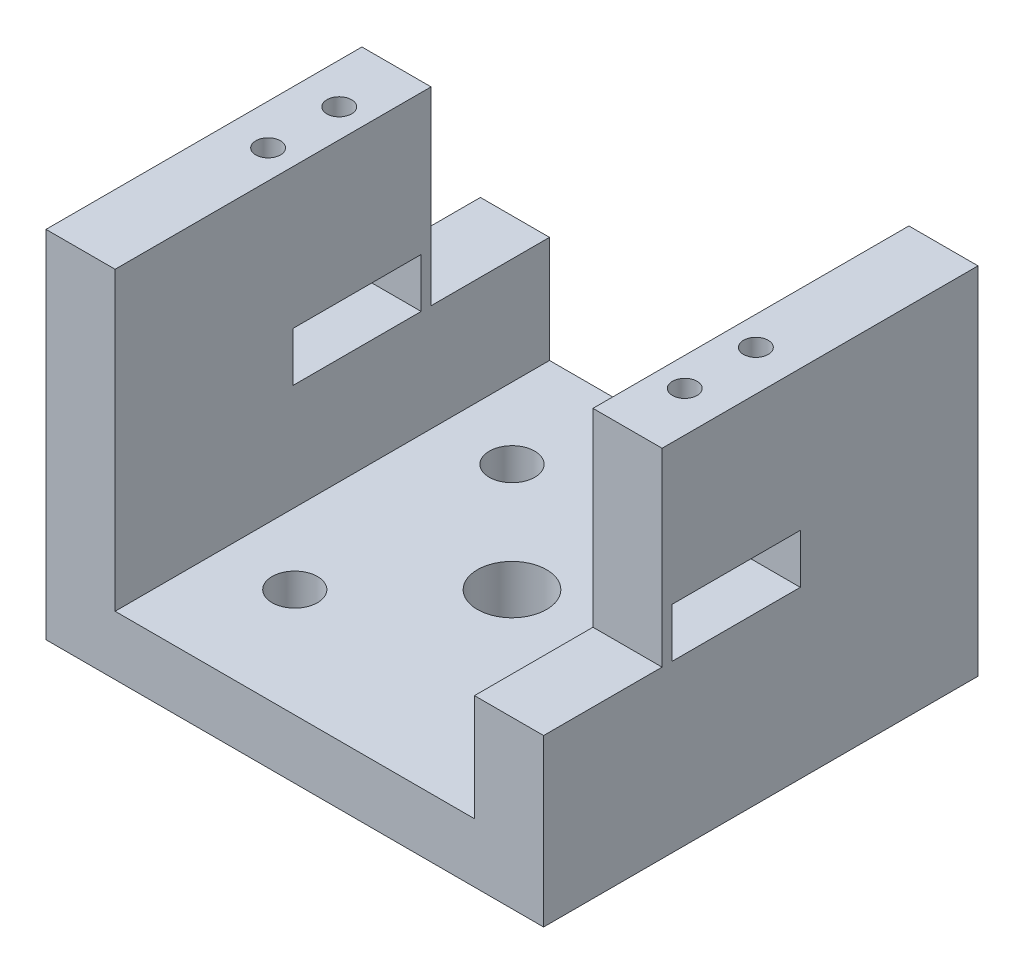
from build123d import *

# Parameters (mm, degrees)
BOSS_EXTRUDE1_DEPTH = 22
SKETCH2_R           = 1.25
CUT_EXTRUDE1_DEPTH  = 16
CUT_EXTRUDE2_REACH  = 64.643
SKETCH4_W           = 7
SKETCH4_H           = 5
BOSS_EXTRUDE2_DEPTH = 1
CIRPATTERN1_COUNT   = 2
CUT_EXTRUDE3_REACH  = 46.934
SKETCH5_R           = 3.5
SKETCH5_R_2         = 2.3


with BuildPart() as part:
    # Sketch1 → Boss-Extrude1 (new, symmetric)
    with BuildSketch(Plane.XY):
        Polygon((-18.2, 0), (18.2, 0), (18.2, 30), (25.2, 30), (25.2, -6), (-25.2, -6), (-25.2, 30), (-18.2, 30), align=None)
    extrude(amount=BOSS_EXTRUDE1_DEPTH, both=True)

    # Sketch2 → Cut-Extrude1 (cut)
    with BuildSketch(Plane(origin=(0, 30, 0), x_dir=(1, 0, 0), z_dir=(0, 1, 0))):
        with Locations((-21.1, -3.6)):
            Circle(SKETCH2_R)
        with Locations((-21.1, 3.6)):
            Circle(SKETCH2_R)
        with Locations((21.1, 3.6)):
            Circle(SKETCH2_R)
        with Locations((21.1, -3.6)):
            Circle(SKETCH2_R)
    extrude(amount=-CUT_EXTRUDE1_DEPTH, mode=Mode.SUBTRACT)

    # Sketch3 → Cut-Extrude2 (cut, up to next)
    with BuildSketch(Plane(origin=(25.2, 0, 0), x_dir=(0, 0, -1), z_dir=(1, 0, 0)), mode=Mode.PRIVATE) as cut_extrude2_sk1:
        Polygon((-22, 30), (-22, 10.8), (4, 10.8), (4, 15.8), (-10, 15.8), (-10, 30), align=None)
    cut_extrude2_tool1 = extrude(cut_extrude2_sk1.sketch, amount=-CUT_EXTRUDE2_REACH, mode=Mode.PRIVATE) & part.part
    cut_extrude2 = cut_extrude2_tool1.solids().sort_by_distance((25.2, 18.745539, 12.970706))[0]
    add(cut_extrude2, mode=Mode.SUBTRACT)

    # Sketch4 → Boss-Extrude2 (add)
    with BuildSketch(Plane.XY.offset(10)):
        with Locations((21.7, 13.3)):
            Rectangle(SKETCH4_W, SKETCH4_H)
    boss_extrude2 = extrude(amount=-BOSS_EXTRUDE2_DEPTH)

    # CirPattern1: Cut-Extrude2, Boss-Extrude2 ×2 about axis
    cirpattern1_axis = Axis((0, -7.8, 0), (0, 1, 0))
    add([cut_extrude2.rotate(cirpattern1_axis, i * 360 / CIRPATTERN1_COUNT) for i in range(1, CIRPATTERN1_COUNT)], mode=Mode.SUBTRACT)
    add([boss_extrude2.rotate(cirpattern1_axis, i * 360 / CIRPATTERN1_COUNT) for i in range(1, CIRPATTERN1_COUNT)])

    # Sketch5 → Cut-Extrude3 (cut, up to next)
    with BuildSketch(Plane(origin=(0, 0, 0), x_dir=(1, 0, 0), z_dir=(0, 1, 0)), mode=Mode.PRIVATE) as cut_extrude3_sk1:
        Circle(SKETCH5_R)
    cut_extrude3_tool1 = extrude(cut_extrude3_sk1.sketch, amount=-CUT_EXTRUDE3_REACH, mode=Mode.PRIVATE) & part.part
    # Sketch5 → Cut-Extrude3 (cut, up to next)
    with BuildSketch(Plane(origin=(0, 0, 0), x_dir=(1, 0, 0), z_dir=(0, 1, 0)), mode=Mode.PRIVATE) as cut_extrude3_sk2:
        with Locations((-11, 11)):
            Circle(SKETCH5_R_2)
    cut_extrude3_tool2 = extrude(cut_extrude3_sk2.sketch, amount=-CUT_EXTRUDE3_REACH, mode=Mode.PRIVATE) & part.part
    # Sketch5 → Cut-Extrude3 (cut, up to next)
    with BuildSketch(Plane(origin=(0, 0, 0), x_dir=(1, 0, 0), z_dir=(0, 1, 0)), mode=Mode.PRIVATE) as cut_extrude3_sk3:
        with Locations((11, 11)):
            Circle(SKETCH5_R_2)
    cut_extrude3_tool3 = extrude(cut_extrude3_sk3.sketch, amount=-CUT_EXTRUDE3_REACH, mode=Mode.PRIVATE) & part.part
    # Sketch5 → Cut-Extrude3 (cut, up to next)
    with BuildSketch(Plane(origin=(0, 0, 0), x_dir=(1, 0, 0), z_dir=(0, 1, 0)), mode=Mode.PRIVATE) as cut_extrude3_sk4:
        with Locations((11, -11)):
            Circle(SKETCH5_R_2)
    cut_extrude3_tool4 = extrude(cut_extrude3_sk4.sketch, amount=-CUT_EXTRUDE3_REACH, mode=Mode.PRIVATE) & part.part
    # Sketch5 → Cut-Extrude3 (cut, up to next)
    with BuildSketch(Plane(origin=(0, 0, 0), x_dir=(1, 0, 0), z_dir=(0, 1, 0)), mode=Mode.PRIVATE) as cut_extrude3_sk5:
        with Locations((-11, -11)):
            Circle(SKETCH5_R_2)
    cut_extrude3_tool5 = extrude(cut_extrude3_sk5.sketch, amount=-CUT_EXTRUDE3_REACH, mode=Mode.PRIVATE) & part.part
    add(cut_extrude3_tool1.solids().sort_by_distance((0, 0, 0))[0], mode=Mode.SUBTRACT)
    add(cut_extrude3_tool2.solids().sort_by_distance((-11, 0, -11))[0], mode=Mode.SUBTRACT)
    add(cut_extrude3_tool3.solids().sort_by_distance((11, 0, -11))[0], mode=Mode.SUBTRACT)
    add(cut_extrude3_tool4.solids().sort_by_distance((11, 0, 11))[0], mode=Mode.SUBTRACT)
    add(cut_extrude3_tool5.solids().sort_by_distance((-11, 0, 11))[0], mode=Mode.SUBTRACT)


solid = part.part
